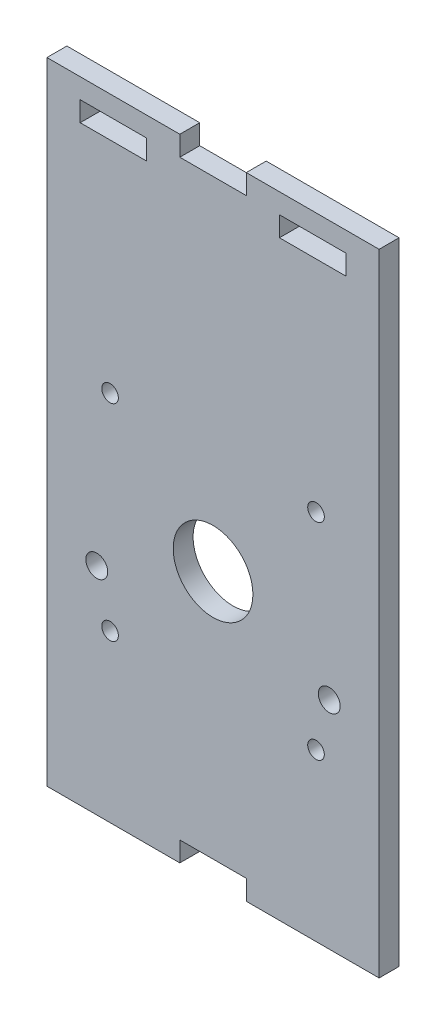
from build123d import *

# Parameters (mm, degrees)
SKETCH1_R           = 6
SKETCH1_R_2         = 1.25
SKETCH1_R_3         = 1.65
SKETCH1_W           = 10
SKETCH1_H           = 3
BOSS_EXTRUDE2_DEPTH = 3


with BuildPart() as part:
    # Sketch1 → Boss-Extrude2 (new body)
    with BuildSketch(Plane.XY):
        Polygon((25, 5), (25, -5.5), (25, -40.5), (5, -40.5), (5, -37.5), (-5, -37.5), (-5, -40.5), (-25, -40.5), (-25, -5.5), (-25, 4.5), (-25, 24.5), (-25, 54.5), (-5, 54.5), (-5, 51.5), (5, 51.5), (5, 54.5), (25, 54.5), (25, 24.5), align=None)
        Circle(SKETCH1_R, mode=Mode.SUBTRACT)
        with Locations((-15.5, 15.5)):
            Circle(SKETCH1_R_2, mode=Mode.SUBTRACT)
        with Locations((15.5, 15.5)):
            Circle(SKETCH1_R_2, mode=Mode.SUBTRACT)
        with Locations((15.5, -15.5)):
            Circle(SKETCH1_R_2, mode=Mode.SUBTRACT)
        with Locations((-15.5, -15.5)):
            Circle(SKETCH1_R_2, mode=Mode.SUBTRACT)
        with Locations((-17.5, -8)):
            Circle(SKETCH1_R_3, mode=Mode.SUBTRACT)
        with Locations((17.5, -8)):
            Circle(SKETCH1_R_3, mode=Mode.SUBTRACT)
        with Locations((-15, 50)):
            Rectangle(SKETCH1_W, SKETCH1_H, mode=Mode.SUBTRACT)
        with Locations((15, 50)):
            Rectangle(SKETCH1_W, SKETCH1_H, mode=Mode.SUBTRACT)
    extrude(amount=BOSS_EXTRUDE2_DEPTH)


solid = part.part
